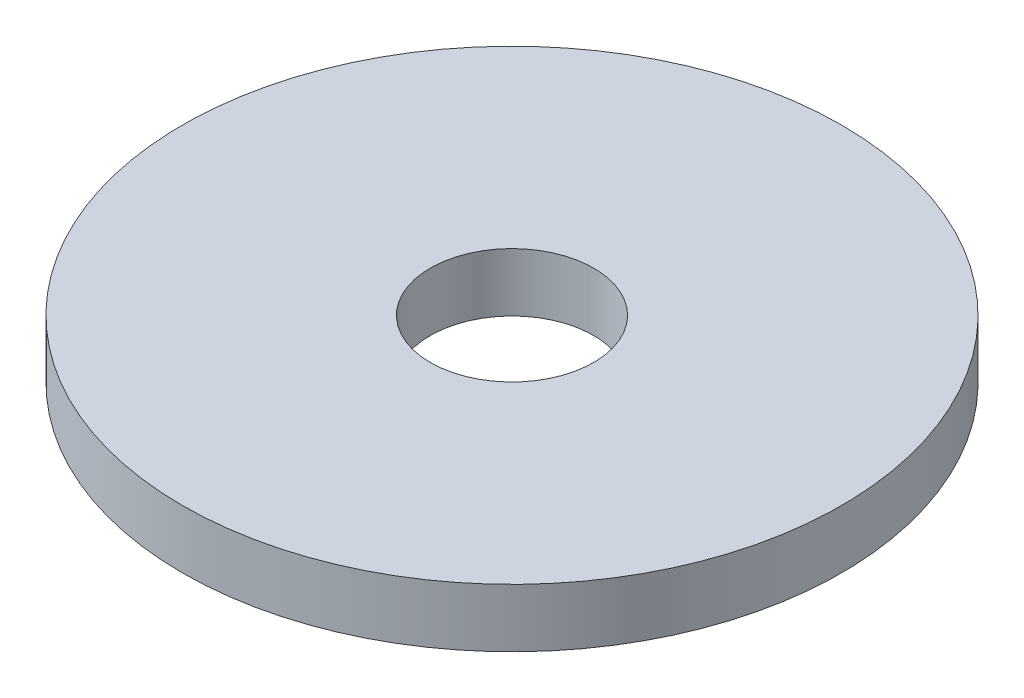
from build123d import *

# Parameters (mm, degrees)
SKETCH1_R           = 2.921
BOSS_EXTRUDE1_DEPTH = 4.000000128
SKETCH2_R           = 4.2333418
BOSS_EXTRUDE2_DEPTH = 0.7499985
SKETCH3_R           = 1.05
CUT_EXTRUDE1_DEPTH  = 8.642306756
SKETCH4_R           = 2.921
CUT_EXTRUDE2_DEPTH  = 4.000000128


with BuildPart() as part:
    # Sketch1 → Boss-Extrude1 (new body)
    with BuildSketch(Plane(origin=(0, 0, 0), x_dir=(1, 0, 0), z_dir=(0, 1, 0))):
        with Locations(Location((0, 0, 0), (0, 0, 270))):
            Circle(SKETCH1_R)
    extrude(amount=BOSS_EXTRUDE1_DEPTH)

    # Sketch2 → Boss-Extrude2 (add)
    with BuildSketch(Plane(origin=(0, 4.000000128, 0), x_dir=(1, 0, 0), z_dir=(0, 1, 0))):
        with Locations(Location((0, 0, 0), (0, 0, 270))):
            Circle(SKETCH2_R)
    extrude(amount=BOSS_EXTRUDE2_DEPTH)

    # Sketch3 → Cut-Extrude1 (cut, through all)
    with BuildSketch(Plane(origin=(0, 4.749998628, 0), x_dir=(1, 0, 0), z_dir=(0, 1, 0))):
        with Locations(Location((0, 0, 0), (0, 0, 270))):
            Circle(SKETCH3_R)
    extrude(amount=-CUT_EXTRUDE1_DEPTH, mode=Mode.SUBTRACT)

    # Sketch4 → Cut-Extrude2 (cut)
    with BuildSketch(Plane.XZ):
        Circle(SKETCH4_R)
    extrude(amount=-CUT_EXTRUDE2_DEPTH, mode=Mode.SUBTRACT)


solid = part.part
